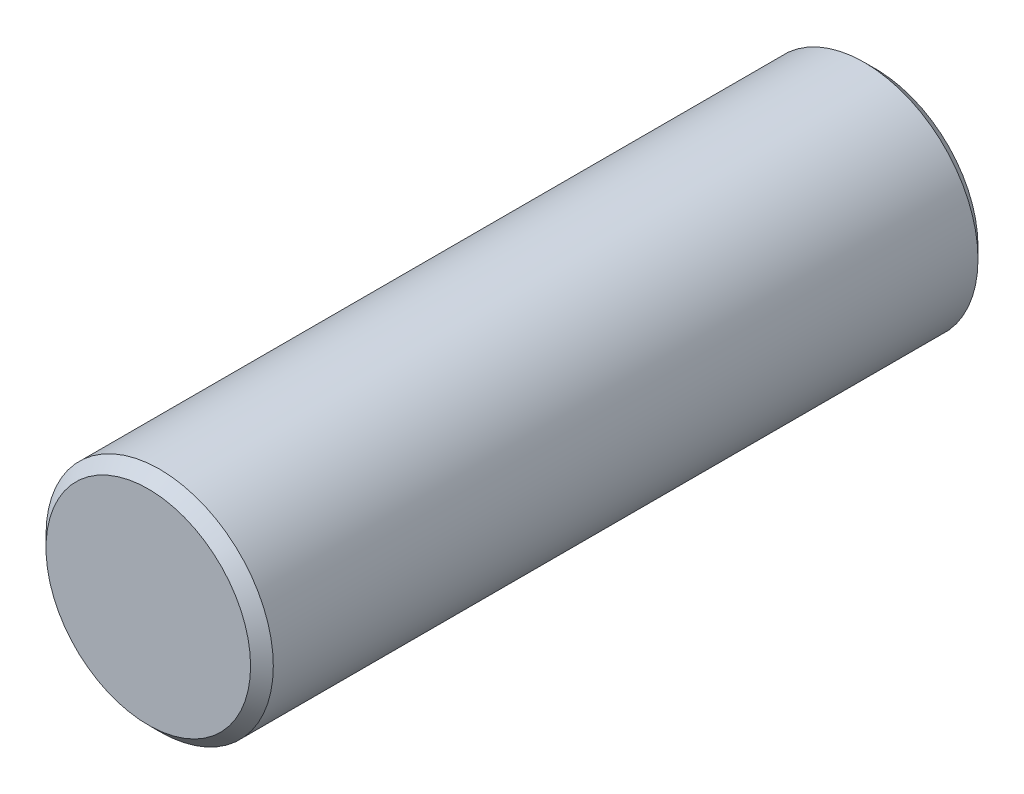
from build123d import *

# Parameters (mm, degrees)
SKETCH1_R           = 2.5
BOSS_EXTRUDE1_DEPTH = 8
CHAMFER1_SIZE       = 0.25


with BuildPart() as part:
    # Sketch1 → Boss-Extrude1 (new, symmetric)
    with BuildSketch(Plane.XY):
        Circle(SKETCH1_R)
    extrude(amount=BOSS_EXTRUDE1_DEPTH, both=True)

    # Chamfer1
    chamfer1_edges = [part.edges().sort_by_distance(p)[0] for p in [
        (-2.5, 0, -8),
        (-2.5, 0, 8),
    ]]
    chamfer(chamfer1_edges, length=CHAMFER1_SIZE)


solid = part.part
